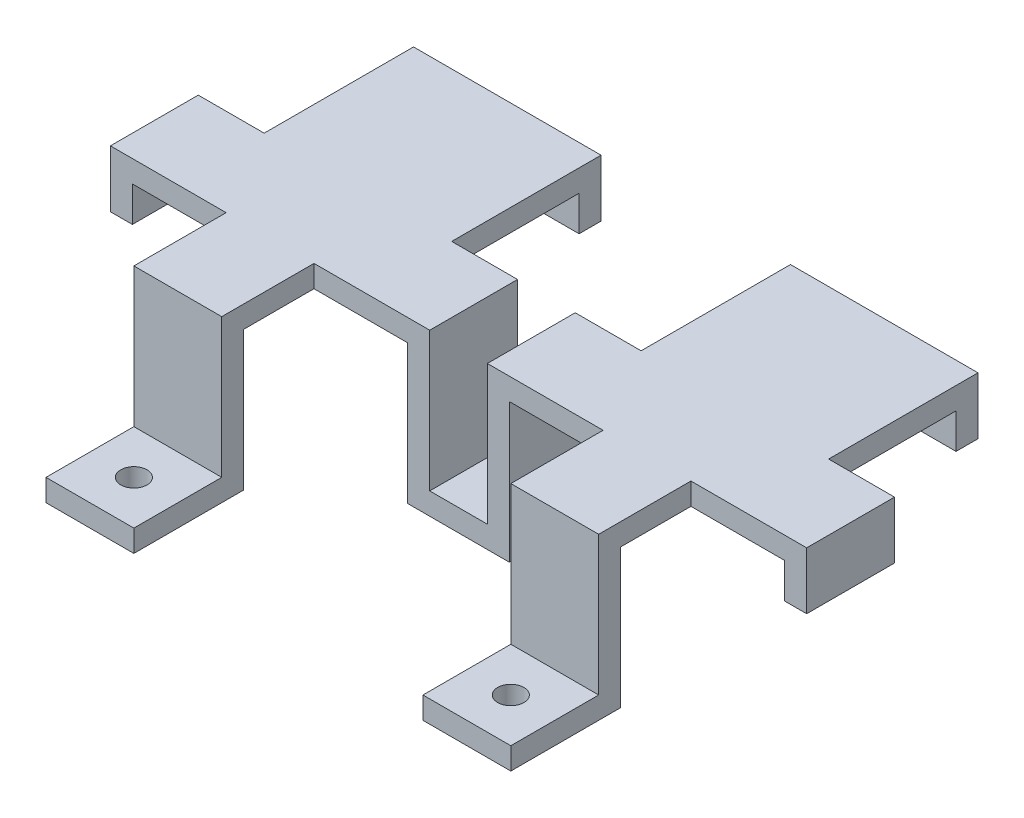
from build123d import *

# Parameters (mm, degrees)
SKETCH1_W             = 100.6348
SKETCH1_H             = 12.7
BOSS_EXTRUDE1_DEPTH   = 3.175
SKETCH2_W             = 3.175
SKETCH2_H             = 12.7
BOSS_EXTRUDE2_DEPTH   = 5.08
SKETCH3_W             = 14.6812
SKETCH3_H             = 12.7
BOSS_EXTRUDE3_DEPTH   = 20.1168
SKETCH4_W             = 8.3312
SKETCH4_H             = 20.1168
CUT_EXTRUDE1_DEPTH    = 20.1168
SKETCH5_W             = 27.1018
SKETCH5_H             = 21.59
BOSS_EXTRUDE4_DEPTH   = 3.175
SKETCH6_W             = 27.1018
SKETCH6_H             = 3.175
BOSS_EXTRUDE5_DEPTH   = 5.08
SKETCH7_W             = 12.7
SKETCH7_H             = 13.335
BOSS_EXTRUDE6_DEPTH   = 3.175
SKETCH8_W             = 12.7
SKETCH8_H             = 3.175
BOSS_EXTRUDE7_DEPTH   = 20.1168
SKETCH9_W             = 12.7
SKETCH9_H             = 3.175
BOSS_EXTRUDE8_DEPTH   = 12.7
SKETCH10_W            = 14.6812
SKETCH10_H            = 3.175
BOSS_EXTRUDE9_DEPTH   = 12.7
F_6_CLEARANCE_HOLE1_D = 3.7973


with BuildPart() as part:
    # Sketch1 → Boss-Extrude1 (new body)
    with BuildSketch(Plane(origin=(0, 0, 0), x_dir=(1, 0, 0), z_dir=(0, 1, 0))):
        Rectangle(SKETCH1_W, SKETCH1_H)
    extrude(amount=BOSS_EXTRUDE1_DEPTH)

    # Sketch2 → Boss-Extrude2 (add)
    with BuildSketch(Plane.XZ):
        with Locations((-48.7299, 0)):
            Rectangle(SKETCH2_W, SKETCH2_H)
        with Locations((48.7299, 0)):
            Rectangle(SKETCH2_W, SKETCH2_H)
    extrude(amount=BOSS_EXTRUDE2_DEPTH)

    # Sketch3 → Boss-Extrude3 (add)
    with BuildSketch(Plane.XZ):
        Rectangle(SKETCH3_W, SKETCH3_H)
    extrude(amount=BOSS_EXTRUDE3_DEPTH)

    # Sketch4 → Cut-Extrude1 (cut)
    with BuildSketch(Plane.XY.offset(6.35)):
        with Locations((0, -6.8834)):
            Rectangle(SKETCH4_W, SKETCH4_H)
    extrude(amount=-CUT_EXTRUDE1_DEPTH, mode=Mode.SUBTRACT)

    # Sketch5 → Boss-Extrude4 (add)
    with BuildSketch(Plane.XZ):
        with Locations((-27.2415, -17.145)):
            Rectangle(SKETCH5_W, SKETCH5_H)
        with Locations((27.2415, -17.145)):
            Rectangle(SKETCH5_W, SKETCH5_H)
    extrude(amount=-BOSS_EXTRUDE4_DEPTH)

    # Sketch6 → Boss-Extrude5 (add)
    with BuildSketch(Plane.XZ):
        with Locations((-27.2415, -26.3525)):
            Rectangle(SKETCH6_W, SKETCH6_H)
        with Locations((27.2415, -26.3525)):
            Rectangle(SKETCH6_W, SKETCH6_H)
    extrude(amount=BOSS_EXTRUDE5_DEPTH)

    # Sketch7 → Boss-Extrude6 (add)
    with BuildSketch(Plane.XZ):
        with Locations((-27.2415, 13.0175)):
            Rectangle(SKETCH7_W, SKETCH7_H)
        with Locations((27.2415, 13.0175)):
            Rectangle(SKETCH7_W, SKETCH7_H)
    extrude(amount=-BOSS_EXTRUDE6_DEPTH)

    # Sketch8 → Boss-Extrude7 (add)
    with BuildSketch(Plane.XZ):
        with Locations((-27.2415, 18.0975)):
            Rectangle(SKETCH8_W, SKETCH8_H)
        with Locations((27.2415, 18.0975)):
            Rectangle(SKETCH8_W, SKETCH8_H)
    extrude(amount=BOSS_EXTRUDE7_DEPTH)

    # Sketch9 → Boss-Extrude8 (add)
    with BuildSketch(Plane.XY.offset(19.685)):
        with Locations((-27.2415, -18.5293)):
            Rectangle(SKETCH9_W, SKETCH9_H)
        with Locations((27.2415, -18.5293)):
            Rectangle(SKETCH9_W, SKETCH9_H)
    extrude(amount=BOSS_EXTRUDE8_DEPTH)

    # Sketch10 → Boss-Extrude9 (add)
    with BuildSketch(Plane(origin=(0, 0, -6.35), x_dir=(-1, 0, 0), z_dir=(0, 0, -1))):
        with Locations((0, -18.5293)):
            Rectangle(SKETCH10_W, SKETCH10_H)
    extrude(amount=BOSS_EXTRUDE9_DEPTH)

    # #6 Clearance Hole1 (through all)
    with Locations(Plane(origin=(0, -16.9418, -12.7), x_dir=(0, 0, 1), z_dir=(0, 1, 0))):
        with Locations((0, 0), (38.735, -27.2415), (38.735, 27.2415)):
            Hole(F_6_CLEARANCE_HOLE1_D / 2)


solid = part.part
